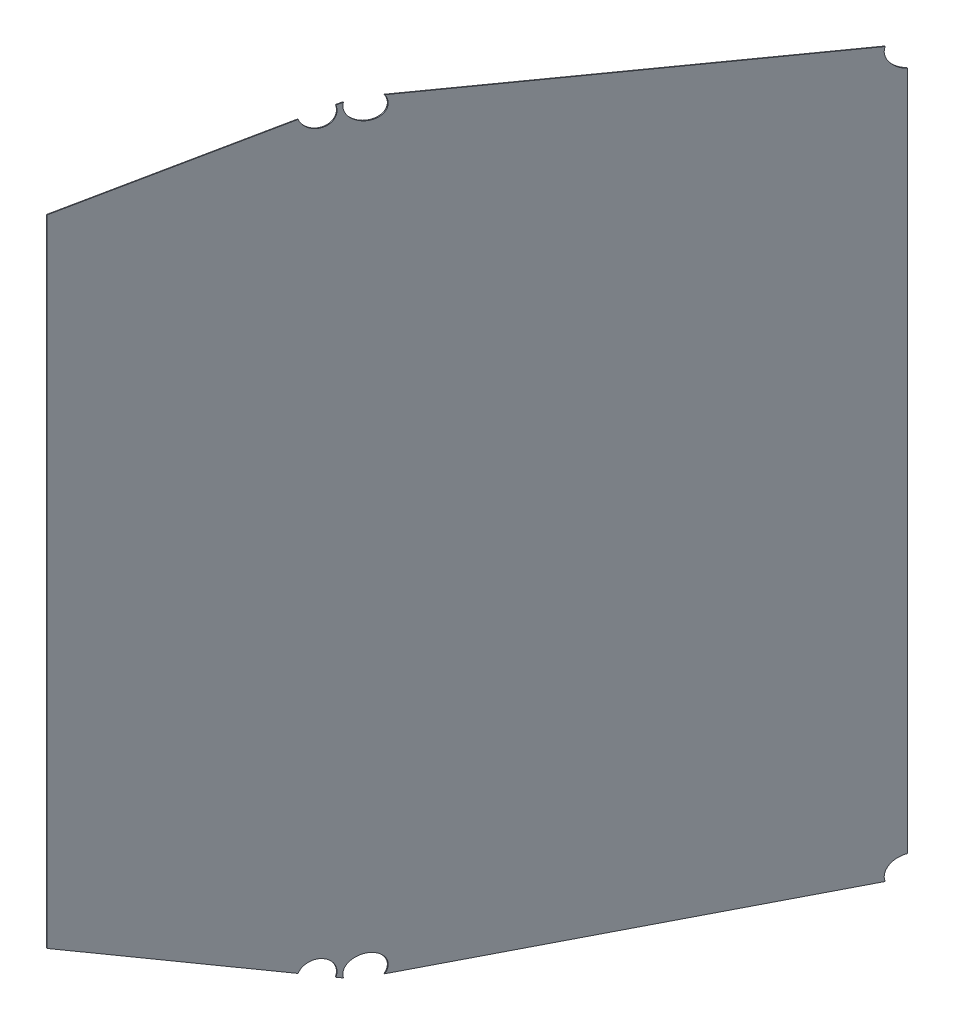
from build123d import *

# Parameters (mm, degrees)
BOSS_EXTRUDE1_DEPTH = 0.3175
SKETCH4_R           = 12.8905
CUT_EXTRUDE1_DEPTH  = 152.4
SKETCH5_R           = 12.8905
CUT_EXTRUDE2_DEPTH  = 152.4
SKETCH6_R           = 12.8905
CUT_EXTRUDE3_DEPTH  = 152.4


with BuildPart() as part:
    # Sketch3 → Boss-Extrude1 (new, symmetric)
    with BuildSketch(Plane(origin=(348.778890993, 0, 212.329779666), x_dir=(0.5199998127813809, 0, -0.8541663741375733), z_dir=(0.8541663741375732, 0, 0.5199998127813807))):
        Polygon((310.98364901, 0), (310.98364901, 336.55), (-63.66635099, 356.184574508), (-273.21635099, 296.314909512), (-273.21635099, 0), align=None)
        Polygon((310.98364901, -336.55), (310.98364901, 0), (-273.21635099, 0), (-273.21635099, -296.314909512), (-63.66635099, -356.184574508), align=None)
    extrude(amount=BOSS_EXTRUDE1_DEPTH, both=True)

    # Sketch4 → Cut-Extrude1 (cut)
    with BuildSketch(Plane(origin=(381.685291714, 370.332, -52.606299668), x_dir=(0, 0, 1), z_dir=(-0.9561624329152195, 0.2928368178382775, -1.8574865237166822e-15))):
        Circle(SKETCH4_R)
    cut_extrude1 = extrude(amount=-CUT_EXTRUDE1_DEPTH, mode=Mode.SUBTRACT)

    # Sketch5 → Cut-Extrude2 (cut)
    with BuildSketch(Plane(origin=(197.535291714, 368.359946538, 264.893700332), x_dir=(0.030514213110192947, -0.004769178985910532, 0.9995229550791048), z_dir=(-0.9875341258250983, 0.1543453532210323, 0.030884660754716436))):
        Circle(SKETCH5_R)
    cut_extrude2 = extrude(amount=-CUT_EXTRUDE2_DEPTH, mode=Mode.SUBTRACT)

    # Sketch6 → Cut-Extrude3 (cut)
    with BuildSketch(Plane(origin=(197.535291714, 368.359946538, 264.893700332), x_dir=(-0.21852016174317612, 0.041163818910951826, 0.9749638346751137), z_dir=(-0.9581125757641108, 0.1804848223177332, -0.22236348862976021))):
        Circle(SKETCH6_R)
    cut_extrude3 = extrude(amount=-CUT_EXTRUDE3_DEPTH, mode=Mode.SUBTRACT)

    # Mirror1: Cut-Extrude1, Cut-Extrude2, Cut-Extrude3 across plane
    add(cut_extrude1.mirror(Plane.ZX), mode=Mode.SUBTRACT)
    add(cut_extrude2.mirror(Plane.ZX), mode=Mode.SUBTRACT)
    add(cut_extrude3.mirror(Plane.ZX), mode=Mode.SUBTRACT)


solid = part.part
